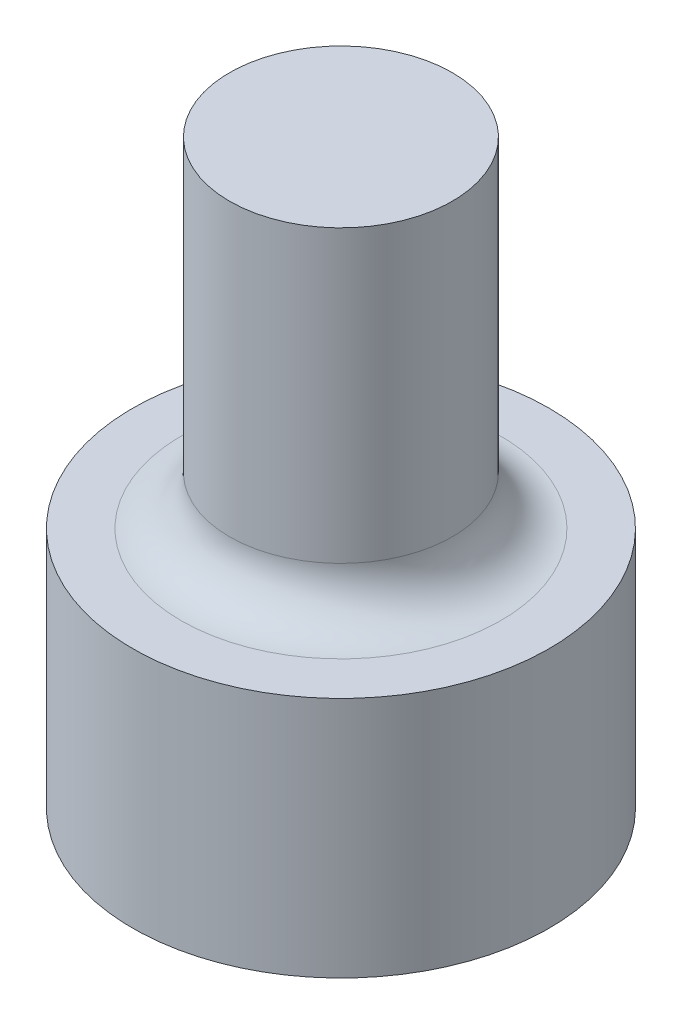
from build123d import *

# Parameters (mm, degrees)
SKETCH6_R           = 5.461
BOSS_EXTRUDE4_DEPTH = 15.24
SKETCH7_OUTSIDE_W   = 17.262
SKETCH7_OUTSIDE_H   = 17.262
SKETCH7_OUTSIDE_R   = 2.921
CUT_EXTRUDE2_DEPTH  = 8.89
SKETCH8_R           = 4.8895
CUT_EXTRUDE3_DEPTH  = 5.08
FILLET2_R           = 1.27


with BuildPart() as part:
    # Sketch6 → Boss-Extrude4 (new body)
    with BuildSketch(Plane(origin=(0, 0, 0), x_dir=(1, 0, 0), z_dir=(0, 1, 0))):
        with Locations(Location((0, 0, 0), (0, 0, 90))):
            Circle(SKETCH6_R)
    extrude(amount=BOSS_EXTRUDE4_DEPTH)

    # Sketch7 outside → Cut-Extrude2 (cut)
    with BuildSketch(Plane(origin=(0, 15.24, 0), x_dir=(1, 0, 0), z_dir=(0, 1, 0))):
        Rectangle(SKETCH7_OUTSIDE_W, SKETCH7_OUTSIDE_H)
        with Locations(Location((0, 0, 0), (0, 0, 270))):
            Circle(SKETCH7_OUTSIDE_R, mode=Mode.SUBTRACT)
    extrude(amount=-CUT_EXTRUDE2_DEPTH, mode=Mode.SUBTRACT)

    # Sketch8 → Cut-Extrude3 (cut)
    with BuildSketch(Plane.XZ):
        with Locations(Location((0, 0, 0), (0, 0, 270))):
            Circle(SKETCH8_R)
    extrude(amount=-CUT_EXTRUDE3_DEPTH, mode=Mode.SUBTRACT)

    # Fillet2
    fillet2_edges = [part.edges().sort_by_distance(p)[0] for p in [
        (0, 6.35, -2.921),
    ]]
    fillet(fillet2_edges, radius=FILLET2_R)


solid = part.part
